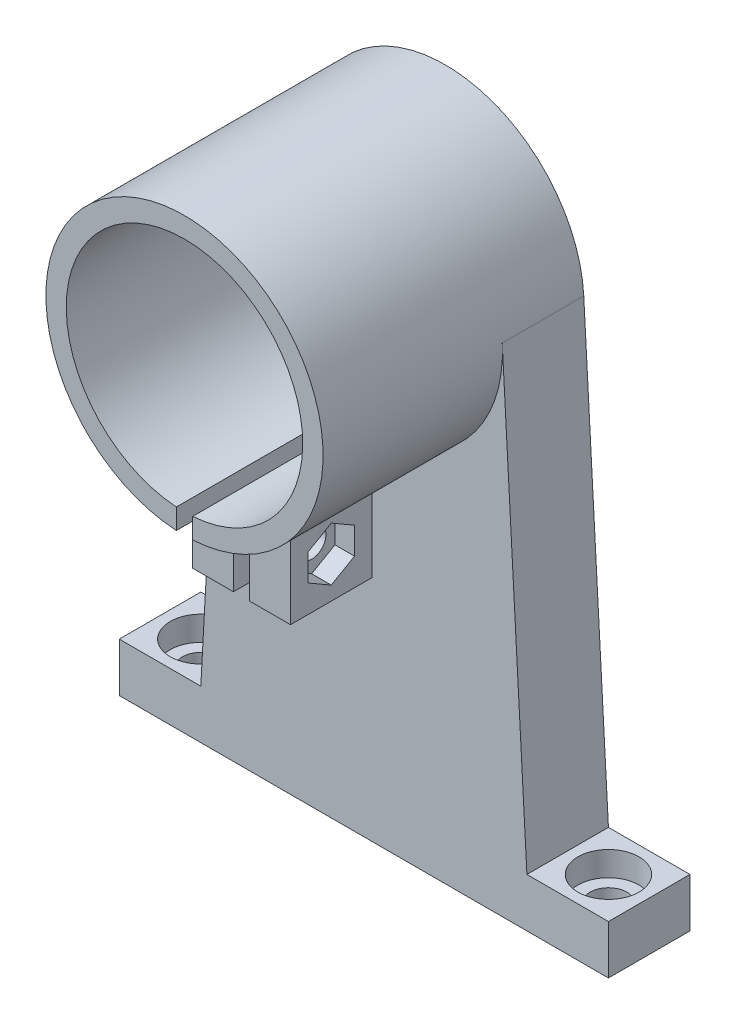
from build123d import *

# Parameters (mm, degrees)
SCHIZZO1_R                   = 17
SCHIZZO1_R_2                 = 5.1
ESTRUSIONE_ESTRUSIONE1_DEPTH = 2
SCHIZZO2_R                   = 17
SCHIZZO2_R_2                 = 14.5
ESTRUSIONE_ESTRUSIONE2_DEPTH = 30
TAGLIO_ESTRUSIONE1_START     = -24
TAGLIO_ESTRUSIONE1_DEPTH     = 24
SCHIZZO4_W                   = 10
SCHIZZO4_H                   = 10
SCHIZZO4_R                   = 1.75
ESTRUSIONE_ESTRUSIONE4_DEPTH = 5
SCHIZZO6_W                   = 5
SCHIZZO6_H                   = 10
ESTRUSIONE_ESTRUSIONE5_DEPTH = 1
TAGLIO_ESTRUSIONE2_DEPTH     = 2.4
SCHIZZO8_R                   = 3.5
TAGLIO_ESTRUSIONE3_DEPTH     = 2.4
ESTRUSIONE_ESTRUSIONE6_DEPTH = 10
SCHIZZO10_R                  = 2.25
TAGLIO_ESTRUSIONE4_DEPTH     = 6
SCHIZZO11_R                  = 3.75
TAGLIO_ESTRUSIONE5_DEPTH     = 3


with BuildPart() as part:
    # Schizzo1 → Estrusione-Estrusione1 (new body)
    with BuildSketch(Plane.XY):
        Circle(SCHIZZO1_R)
        Circle(SCHIZZO1_R_2, mode=Mode.SUBTRACT)
    extrude(amount=ESTRUSIONE_ESTRUSIONE1_DEPTH)

    # Schizzo2 → Estrusione-Estrusione2 (add)
    with BuildSketch(Plane.XY.offset(2)):
        Circle(SCHIZZO2_R)
        Circle(SCHIZZO2_R_2, mode=Mode.SUBTRACT)
    extrude(amount=ESTRUSIONE_ESTRUSIONE2_DEPTH)

    # Schizzo3 → Taglio-Estrusione1 (cut)
    with BuildSketch(Plane.XY.offset(32).offset(TAGLIO_ESTRUSIONE1_START)):
        with BuildLine():
            Line((0, -17), (0, -14.5))
            ThreePointArc((0, -14.5), (-0.500297885, -14.491366465), (-1, -14.465476141))
            Line((-1, -14.465476141), (-1, -16.970562748))
            ThreePointArc((-1, -16.970562748), (-0.500216591, -16.992639094), (0, -17))
        make_face()
        with BuildLine():
            ThreePointArc((1, -14.465476141), (0.500297885, -14.491366465), (0, -14.5))
            Line((0, -14.5), (0, -17))
            ThreePointArc((0, -17), (0.500216591, -16.992639094), (1, -16.970562748))
            Line((1, -16.970562748), (1, -14.465476141))
        make_face()
    extrude(amount=TAGLIO_ESTRUSIONE1_DEPTH, mode=Mode.SUBTRACT)



with BuildPart() as body_2:
    # Schizzo4 → Estrusione-Estrusione4 (new body)
    with BuildSketch(Plane.ZY.offset(-1)):
        with Locations((20, -21.970562748)):
            Rectangle(SCHIZZO4_W, SCHIZZO4_H)
        with Locations(Location((20, -21.970562748, 0), (0, 0, 270))):
            Circle(SCHIZZO4_R, mode=Mode.SUBTRACT)
    estrusione_estrusione4 = extrude(amount=-ESTRUSIONE_ESTRUSIONE4_DEPTH)


with BuildPart() as part_1:
    add(part.part)

    add(body_2.part)  # Estrusione-Estrusione5 merges body 2
    # Schizzo6 → Estrusione-Estrusione5 (add)
    with BuildSketch(Plane(origin=(0, -16.970562748, 0), x_dir=(1, 0, 0), z_dir=(0, 1, 0))):
        with Locations((3.5, -20)):
            Rectangle(SCHIZZO6_W, SCHIZZO6_H)
    estrusione_estrusione5 = extrude(amount=ESTRUSIONE_ESTRUSIONE5_DEPTH)

    # Specchia4: Estrusione-Estrusione5 across plane
    add(estrusione_estrusione5.mirror(Plane(origin=(0, 0, 0), x_dir=(0, 0, 1), z_dir=(1, 0, 0))))

    # Specchia5: Estrusione-Estrusione4 across plane
    add(estrusione_estrusione4.mirror(Plane(origin=(0, 0, 0), x_dir=(0, 0, 1), z_dir=(1, 0, 0))))

    # Schizzo7 → Taglio-Estrusione2 (cut)
    with BuildSketch(Plane(origin=(6, 0, 0), x_dir=(0, 0, -1), z_dir=(1, 0, 0))):
        Polygon((-20, -18.679666214), (-22.85, -20.325114481), (-22.85, -23.616011016), (-20, -25.261459283), (-17.15, -23.616011016), (-17.15, -20.325114481), align=None)
    extrude(amount=-TAGLIO_ESTRUSIONE2_DEPTH, mode=Mode.SUBTRACT)

    # Schizzo8 → Taglio-Estrusione3 (cut)
    with BuildSketch(Plane.ZY.offset(6)):
        with Locations(Location((20, -21.970562748, 0), (0, 0, 270))):
            Circle(SCHIZZO8_R)
    extrude(amount=-TAGLIO_ESTRUSIONE3_DEPTH, mode=Mode.SUBTRACT)

    # Schizzo9 → Estrusione-Estrusione6 (add)
    with BuildSketch(Plane(origin=(0, 0, 0), x_dir=(-1, 0, 0), z_dir=(0, 0, -1))):
        with BuildLine():
            Line((-30, -60), (30, -60))
            Line((30, -60), (30, -54))
            Line((30, -54), (20, -54))
            Line((20, -54), (16.974272663, 0.934915801))
            ThreePointArc((16.974272663, 0.934915801), (0, -17), (-16.974272663, 0.934915801))
            Line((-16.974272663, 0.934915801), (-20, -54))
            Line((-20, -54), (-30, -54))
            Line((-30, -54), (-30, -60))
        make_face()
    extrude(amount=-ESTRUSIONE_ESTRUSIONE6_DEPTH)

    # Schizzo10 → Taglio-Estrusione4 (cut)
    with BuildSketch(Plane(origin=(0, -54, 0), x_dir=(1, 0, 0), z_dir=(0, 1, 0))):
        with Locations(Location((25, -5, 0), (0, 0, 270))):
            Circle(SCHIZZO10_R)
        with Locations(Location((-25, -5, 0), (0, 0, 270))):
            Circle(SCHIZZO10_R)
    extrude(amount=-TAGLIO_ESTRUSIONE4_DEPTH, mode=Mode.SUBTRACT)

    # Schizzo11 → Taglio-Estrusione5 (cut)
    with BuildSketch(Plane(origin=(0, -54, 0), x_dir=(1, 0, 0), z_dir=(0, 1, 0))):
        with Locations(Location((-25, -5, 0), (0, 0, 270))):
            Circle(SCHIZZO11_R)
        with Locations(Location((25, -5, 0), (0, 0, 270))):
            Circle(SCHIZZO11_R)
    extrude(amount=-TAGLIO_ESTRUSIONE5_DEPTH, mode=Mode.SUBTRACT)


solid = part_1.part
